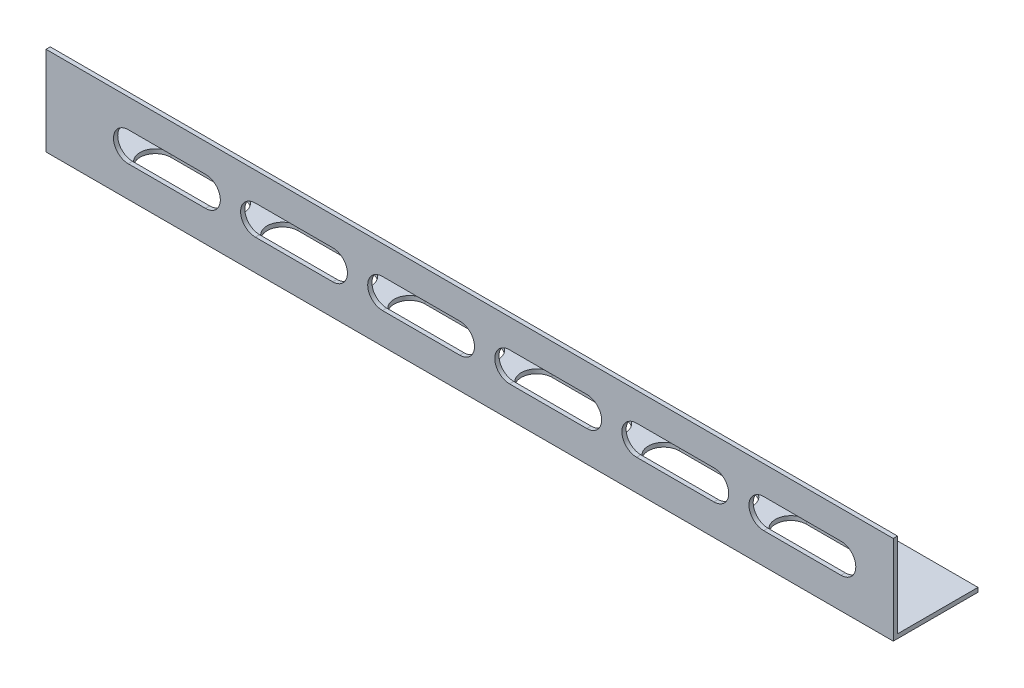
from build123d import *

# Parameters (mm, degrees)
SKETCH1_W           = 150
SKETCH1_H           = 40
BOSS_EXTRUDE1_DEPTH = 2
SKETCH2_W           = 150
SKETCH2_H           = 2
BOSS_EXTRUDE2_DEPTH = 40
BOSS_EXTRUDE3_DEPTH = 250
CUT_EXTRUDE1_DEPTH  = 10
CUT_EXTRUDE2_DEPTH  = 10


with BuildPart() as part:
    # Sketch1 → Boss-Extrude1 (new body)
    with BuildSketch(Plane(origin=(0, 0, 0), x_dir=(1, 0, 0), z_dir=(0, 1, 0))):
        Rectangle(SKETCH1_W, SKETCH1_H)
    extrude(amount=BOSS_EXTRUDE1_DEPTH)

    # Sketch2 → Boss-Extrude2 (add)
    with BuildSketch(Plane(origin=(0, 2, 0), x_dir=(1, 0, 0), z_dir=(0, 1, 0))):
        with Locations((0, -19)):
            Rectangle(SKETCH2_W, SKETCH2_H)
    extrude(amount=BOSS_EXTRUDE2_DEPTH)

    # Sketch5 → Boss-Extrude3 (add)
    with BuildSketch(Plane(origin=(75, 0, 0), x_dir=(0, 0, -1), z_dir=(1, 0, 0))):
        Polygon((-20, 0), (20, 0), (20, 2), (-18, 2), (-18, 42), (-20, 42), align=None)
    extrude(amount=BOSS_EXTRUDE3_DEPTH)

    # Sketch6 → Cut-Extrude1 (cut)
    with BuildSketch(Plane(origin=(0, 0, 18), x_dir=(-1, 0, 0), z_dir=(0, 0, -1))):
        with BuildLine():
            Line((-240.33737868, 28.537373621), (-203.83317873, 28.537373621))
            ThreePointArc((-203.83317873, 28.537373621), (-196.868561634, 21.572756525), (-203.83317873, 14.60813943))
            Line((-203.83317873, 14.60813943), (-240.33737868, 14.60813943))
            ThreePointArc((-240.33737868, 14.60813943), (-247.301995776, 21.572756525), (-240.33737868, 28.537373621))
        make_face()
        with BuildLine():
            Line((-300.33737868, 28.537373621), (-263.83317873, 28.537373621))
            ThreePointArc((-263.83317873, 28.537373621), (-256.868561634, 21.572756525), (-263.83317873, 14.60813943))
            Line((-263.83317873, 14.60813943), (-300.33737868, 14.60813943))
            ThreePointArc((-300.33737868, 14.60813943), (-307.301995776, 21.572756525), (-300.33737868, 28.537373621))
        make_face()
        with BuildLine():
            Line((-180.33737868, 28.537373621), (-143.83317873, 28.537373621))
            ThreePointArc((-143.83317873, 28.537373621), (-136.868561634, 21.572756525), (-143.83317873, 14.60813943))
            Line((-143.83317873, 14.60813943), (-180.33737868, 14.60813943))
            ThreePointArc((-180.33737868, 14.60813943), (-187.301995776, 21.572756525), (-180.33737868, 28.537373621))
        make_face()
        with BuildLine():
            Line((-120.33737868, 28.537373621), (-83.83317873, 28.537373621))
            ThreePointArc((-83.83317873, 28.537373621), (-76.868561634, 21.572756525), (-83.83317873, 14.60813943))
            Line((-83.83317873, 14.60813943), (-120.33737868, 14.60813943))
            ThreePointArc((-120.33737868, 14.60813943), (-127.301995776, 21.572756525), (-120.33737868, 28.537373621))
        make_face()
        with BuildLine():
            Line((-60.33737868, 28.537373621), (-23.83317873, 28.537373621))
            ThreePointArc((-23.83317873, 28.537373621), (-16.868561634, 21.572756525), (-23.83317873, 14.60813943))
            Line((-23.83317873, 14.60813943), (-60.33737868, 14.60813943))
            ThreePointArc((-60.33737868, 14.60813943), (-67.301995776, 21.572756525), (-60.33737868, 28.537373621))
        make_face()
        with BuildLine():
            Line((-0.33737868, 28.537373621), (36.16682127, 28.537373621))
            ThreePointArc((36.16682127, 28.537373621), (43.131438366, 21.572756525), (36.16682127, 14.60813943))
            Line((36.16682127, 14.60813943), (-0.33737868, 14.60813943))
            ThreePointArc((-0.33737868, 14.60813943), (-7.301995776, 21.572756525), (-0.33737868, 28.537373621))
        make_face()
    extrude(amount=-CUT_EXTRUDE1_DEPTH, mode=Mode.SUBTRACT)

    # Sketch7 → Cut-Extrude2 (cut)
    with BuildSketch(Plane.XZ):
        with BuildLine():
            Line((16.675627825, 7.30204443), (51.190762774, 7.30204443))
            ThreePointArc((51.190762774, 7.30204443), (58.492807205, 0), (51.190762774, -7.30204443))
            Line((51.190762774, -7.30204443), (16.675627825, -7.30204443))
            ThreePointArc((16.675627825, -7.30204443), (9.373583394, 0), (16.675627825, 7.30204443))
        make_face()
        with BuildLine():
            Line((-43.324372175, 7.30204443), (-8.809237226, 7.30204443))
            ThreePointArc((-8.809237226, 7.30204443), (-1.507192795, 0), (-8.809237226, -7.30204443))
            Line((-8.809237226, -7.30204443), (-43.324372175, -7.30204443))
            ThreePointArc((-43.324372175, -7.30204443), (-50.626416606, 0), (-43.324372175, 7.30204443))
        make_face()
        with BuildLine():
            Line((76.675627825, 7.30204443), (111.190762774, 7.30204443))
            ThreePointArc((111.190762774, 7.30204443), (118.492807205, 0), (111.190762774, -7.30204443))
            Line((111.190762774, -7.30204443), (76.675627825, -7.30204443))
            ThreePointArc((76.675627825, -7.30204443), (69.373583394, 0), (76.675627825, 7.30204443))
        make_face()
        with BuildLine():
            Line((136.675627825, 7.30204443), (171.190762774, 7.30204443))
            ThreePointArc((171.190762774, 7.30204443), (178.492807205, 0), (171.190762774, -7.30204443))
            Line((171.190762774, -7.30204443), (136.675627825, -7.30204443))
            ThreePointArc((136.675627825, -7.30204443), (129.373583394, 0), (136.675627825, 7.30204443))
        make_face()
        with BuildLine():
            Line((196.675627825, 7.30204443), (231.190762774, 7.30204443))
            ThreePointArc((231.190762774, 7.30204443), (238.492807205, 0), (231.190762774, -7.30204443))
            Line((231.190762774, -7.30204443), (196.675627825, -7.30204443))
            ThreePointArc((196.675627825, -7.30204443), (189.373583394, 0), (196.675627825, 7.30204443))
        make_face()
        with BuildLine():
            Line((256.675627825, 7.30204443), (291.190762774, 7.30204443))
            ThreePointArc((291.190762774, 7.30204443), (298.492807205, 0), (291.190762774, -7.30204443))
            Line((291.190762774, -7.30204443), (256.675627825, -7.30204443))
            ThreePointArc((256.675627825, -7.30204443), (249.373583394, 0), (256.675627825, 7.30204443))
        make_face()
    extrude(amount=-CUT_EXTRUDE2_DEPTH, mode=Mode.SUBTRACT)


solid = part.part
